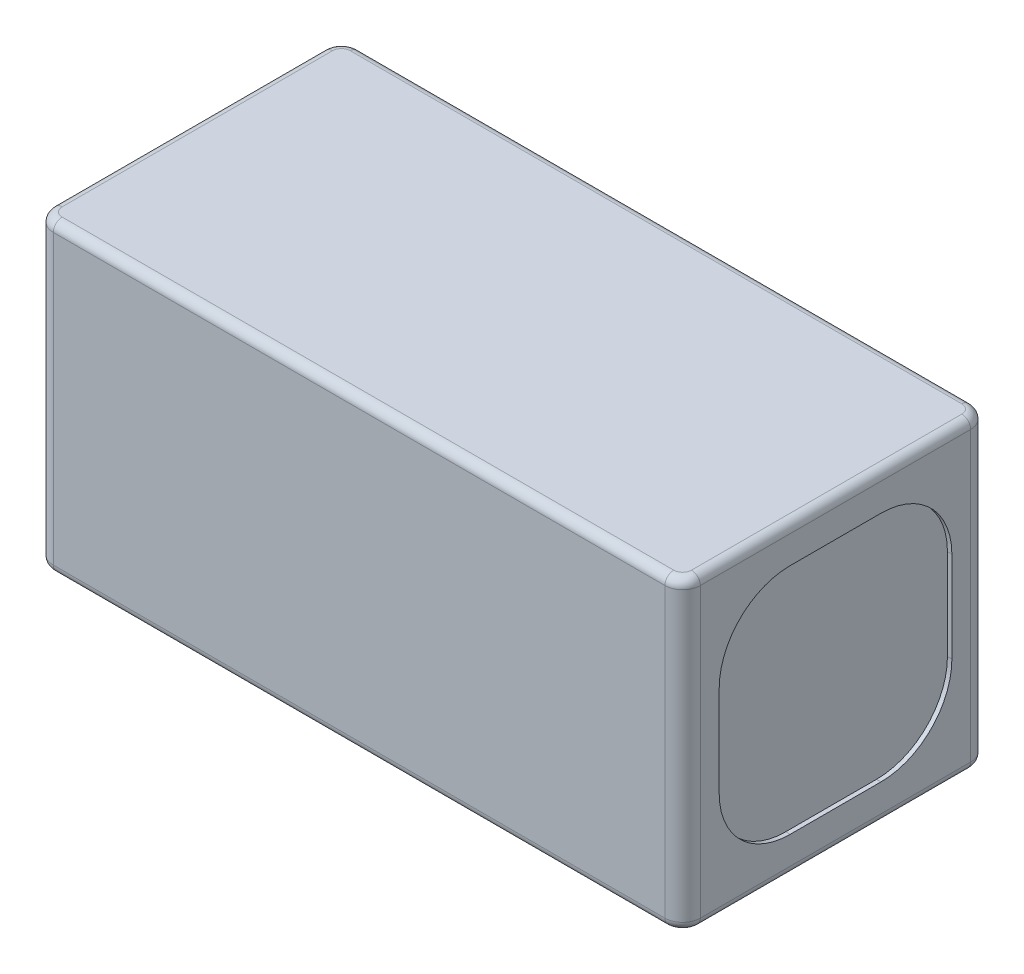
from build123d import *

# Parameters (mm, degrees)
SKETCH1_W           = 73
SKETCH1_H           = 34.5
BOSS_EXTRUDE1_DEPTH = 34.5
CUT_EXTRUDE1_DEPTH  = 0.5
CUT_EXTRUDE2_START  = -0.5
CUT_EXTRUDE2_DEPTH  = 0.5
FILLET1_R           = 2
FILLET2_R           = 1


with BuildPart() as part:
    # Sketch1 → Boss-Extrude1 (new body)
    with BuildSketch(Plane(origin=(0, 0, -15), x_dir=(-1, 0, 0), z_dir=(0, 0, -1))):
        with Locations((-32.5, -4.75)):
            Rectangle(SKETCH1_W, SKETCH1_H)
    extrude(amount=-BOSS_EXTRUDE1_DEPTH)

    # Sketch2 → Cut-Extrude1 (cut)
    with BuildSketch(Plane(origin=(69, 0, 0), x_dir=(0, 0, -1), z_dir=(1, 0, 0))):
        with BuildLine():
            Line((-15.375, 0.375), (-15.375, -9.875))
            ThreePointArc((-15.375, -9.875), (-13.031854249, -15.531854249), (-7.375, -17.875))
            Line((-7.375, -17.875), (2.875, -17.875))
            ThreePointArc((2.875, -17.875), (8.531854249, -15.531854249), (10.875, -9.875))
            Line((10.875, -9.875), (10.875, 0.375))
            ThreePointArc((10.875, 0.375), (8.531854249, 6.031854249), (2.875, 8.375))
            Line((2.875, 8.375), (-7.375, 8.375))
            ThreePointArc((-7.375, 8.375), (-13.031854249, 6.031854249), (-15.375, 0.375))
        make_face()
    extrude(amount=-CUT_EXTRUDE1_DEPTH, mode=Mode.SUBTRACT)

    # Sketch3 → Cut-Extrude2 (cut)
    with BuildSketch(Plane.ZY.offset(4).offset(CUT_EXTRUDE2_START)):
        with BuildLine():
            Line((7.375, 8.375), (-2.875, 8.375))
            ThreePointArc((-2.875, 8.375), (-8.531854249, 6.031854249), (-10.875, 0.375))
            Line((-10.875, 0.375), (-10.875, -9.875))
            ThreePointArc((-10.875, -9.875), (-8.531854249, -15.531854249), (-2.875, -17.875))
            Line((-2.875, -17.875), (7.375, -17.875))
            ThreePointArc((7.375, -17.875), (13.031854249, -15.531854249), (15.375, -9.875))
            Line((15.375, -9.875), (15.375, 0.375))
            ThreePointArc((15.375, 0.375), (13.031854249, 6.031854249), (7.375, 8.375))
        make_face()
    extrude(amount=CUT_EXTRUDE2_DEPTH, mode=Mode.SUBTRACT)

    # Fillet1
    fillet1_edges = [part.edges().sort_by_distance(p)[0] for p in [
        (-4, -4.75, 19.5),
        (69, -4.75, 19.5),
        (-4, -4.75, -15),
        (69, -4.75, -15),
    ]]
    fillet(fillet1_edges, radius=FILLET1_R)

    # Fillet2
    fillet2_edges = [part.edges().sort_by_distance(p)[0] for p in [
        (32.5, -22, -15),
        (32.5, 12.5, -15),
        (-4, 12.5, 2.25),
        (32.5, 12.5, 19.5),
        (69, 12.5, 2.25),
        (68.414213562, 12.5, 18.914213562),
        (68.414213562, 12.5, -14.414213562),
        (-3.414213562, 12.5, 18.914213562),
        (-3.414213562, 12.5, -14.414213562),
        (-4, -22, 2.25),
        (69, -22, 2.25),
        (32.5, -22, 19.5),
        (68.414213562, -22, 18.914213562),
        (68.414213562, -22, -14.414213562),
        (-3.414213562, -22, 18.914213562),
        (-3.414213562, -22, -14.414213562),
    ]]
    fillet(fillet2_edges, radius=FILLET2_R)


solid = part.part
